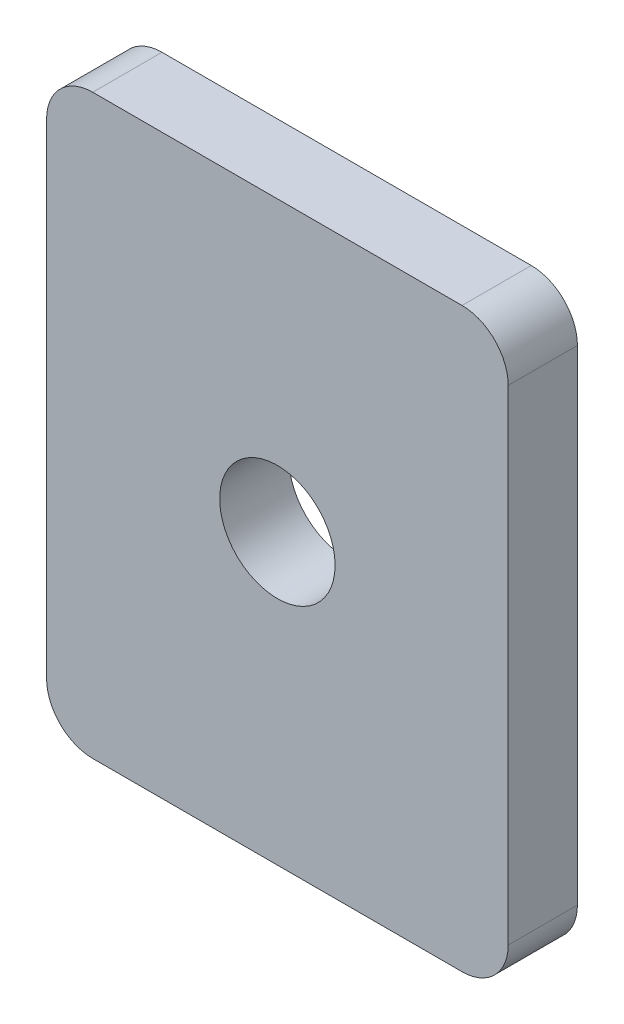
from build123d import *

# Parameters (mm, degrees)
ESQUISSE1_W        = 20
ESQUISSE1_H        = 25
ESQUISSE1_R        = 2.5
BOSS_EXTRU_1_DEPTH = 3
CONG_1_R           = 2


with BuildPart() as part:
    # Esquisse1 → Boss.-Extru.1 (new body)
    with BuildSketch(Plane.XY):
        Rectangle(ESQUISSE1_W, ESQUISSE1_H)
        Circle(ESQUISSE1_R, mode=Mode.SUBTRACT)
    extrude(amount=BOSS_EXTRU_1_DEPTH)

    # Congé1
    cong_1_edges = [part.edges().sort_by_distance(p)[0] for p in [
        (-10, 12.5, 1.5),
        (10, 12.5, 1.5),
        (10, -12.5, 1.5),
        (-10, -12.5, 1.5),
    ]]
    fillet(cong_1_edges, radius=CONG_1_R)


solid = part.part
